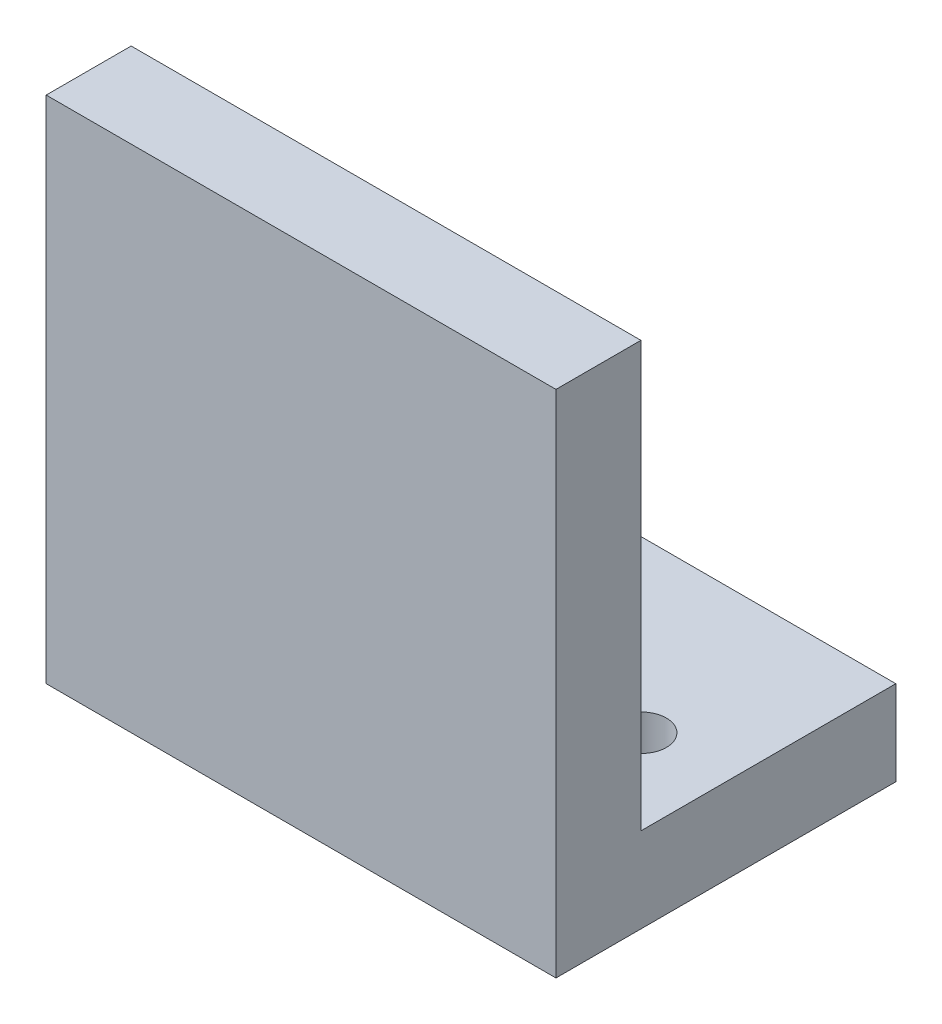
from build123d import *

# Parameters (mm, degrees)
EXTRUDE_1_DEPTH     = 30
SKETCH_2_R          = 1.5
CUT_EXTRUDE_1_DEPTH = 20


with BuildPart() as part:
    # 草图1 → 凸台-拉伸1 (new body)
    with BuildSketch(Plane(origin=(0, 0, 0), x_dir=(0, 0, -1), z_dir=(1, 0, 0))):
        Polygon((0, 25), (0, 0), (15, 0), (15, -5), (-5, -5), (-5, 25), align=None)
    extrude(amount=EXTRUDE_1_DEPTH)

    # 草图2 → 切除-拉伸1 (cut)
    with BuildSketch(Plane(origin=(0, 0, 0), x_dir=(1, 0, 0), z_dir=(0, 1, 0))):
        with Locations(Location((5, 5, 0), (0, 0, 270))):
            Circle(SKETCH_2_R)
        with Locations(Location((25, 5, 0), (0, 0, 270))):
            Circle(SKETCH_2_R)
    extrude(amount=-CUT_EXTRUDE_1_DEPTH, mode=Mode.SUBTRACT)


solid = part.part
